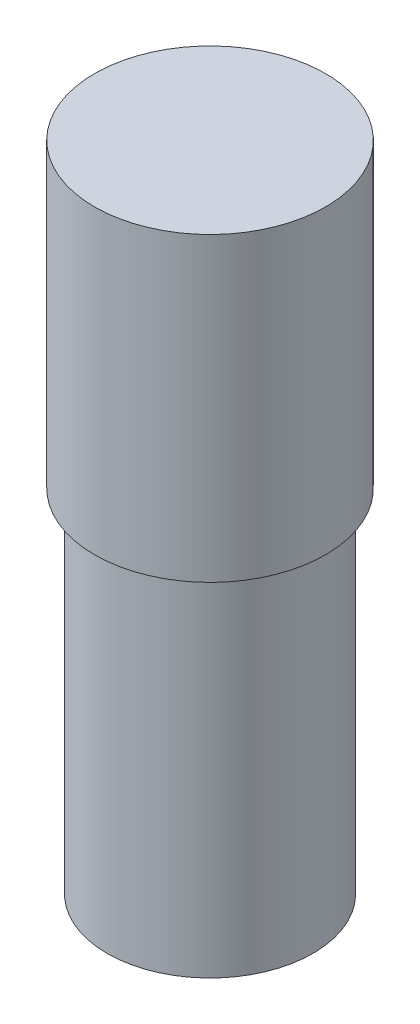
from build123d import *

# Parameters (mm, degrees)
SKETCH_1_R      = 2.05
EXTRUDE_1_DEPTH = 7
SKETCH_2_R      = 2.3
EXTRUDE_2_DEPTH = 6


with BuildPart() as part:
    # 草图1 → 凸台-拉伸1 (new body)
    with BuildSketch(Plane(origin=(0, 0, 0), x_dir=(1, 0, 0), z_dir=(0, 1, 0))):
        with Locations(Location((0, 0, 0), (0, 0, 270))):
            Circle(SKETCH_1_R)
    extrude(amount=EXTRUDE_1_DEPTH)

    # 草图2 → 凸台-拉伸2 (add)
    with BuildSketch(Plane(origin=(0, 7, 0), x_dir=(1, 0, 0), z_dir=(0, 1, 0))):
        with Locations(Location((0, 0, 0), (0, 0, 270))):
            Circle(SKETCH_2_R)
    extrude(amount=EXTRUDE_2_DEPTH)


solid = part.part
